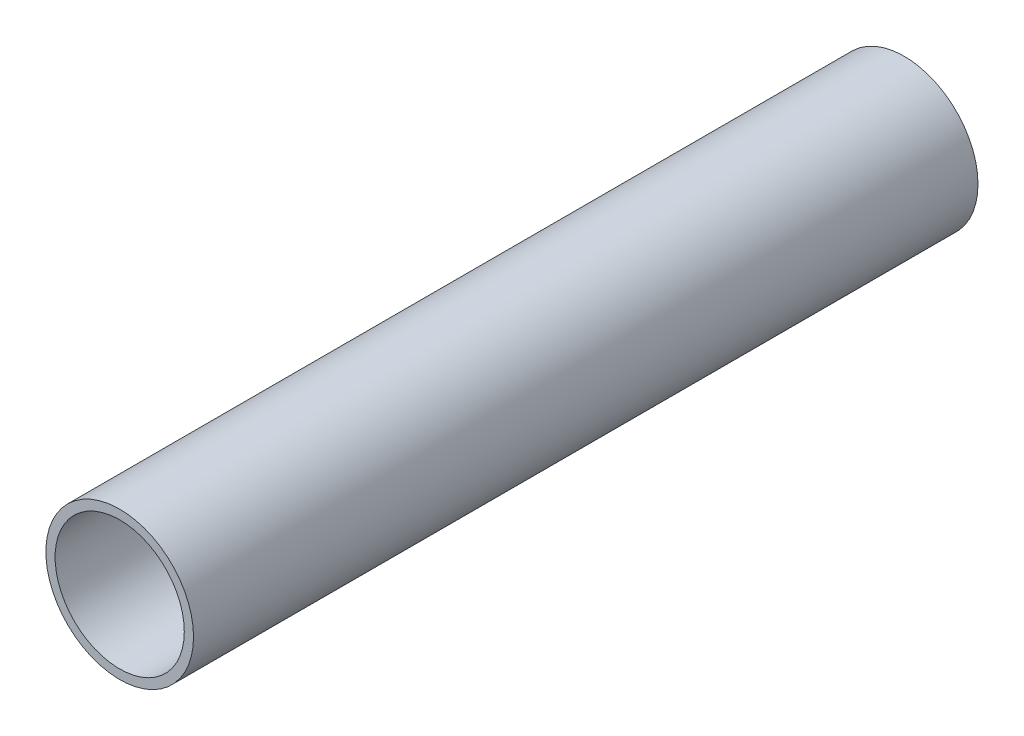
from build123d import *

# Parameters (mm, degrees)
SKETCH1_R           = 8
SKETCH1_R_2         = 7
BOSS_EXTRUDE1_DEPTH = 85


with BuildPart() as part:
    # Sketch1 → Boss-Extrude1 (new body)
    with BuildSketch(Plane.XY):
        Circle(SKETCH1_R)
        Circle(SKETCH1_R_2, mode=Mode.SUBTRACT)
    extrude(amount=BOSS_EXTRUDE1_DEPTH)


solid = part.part
